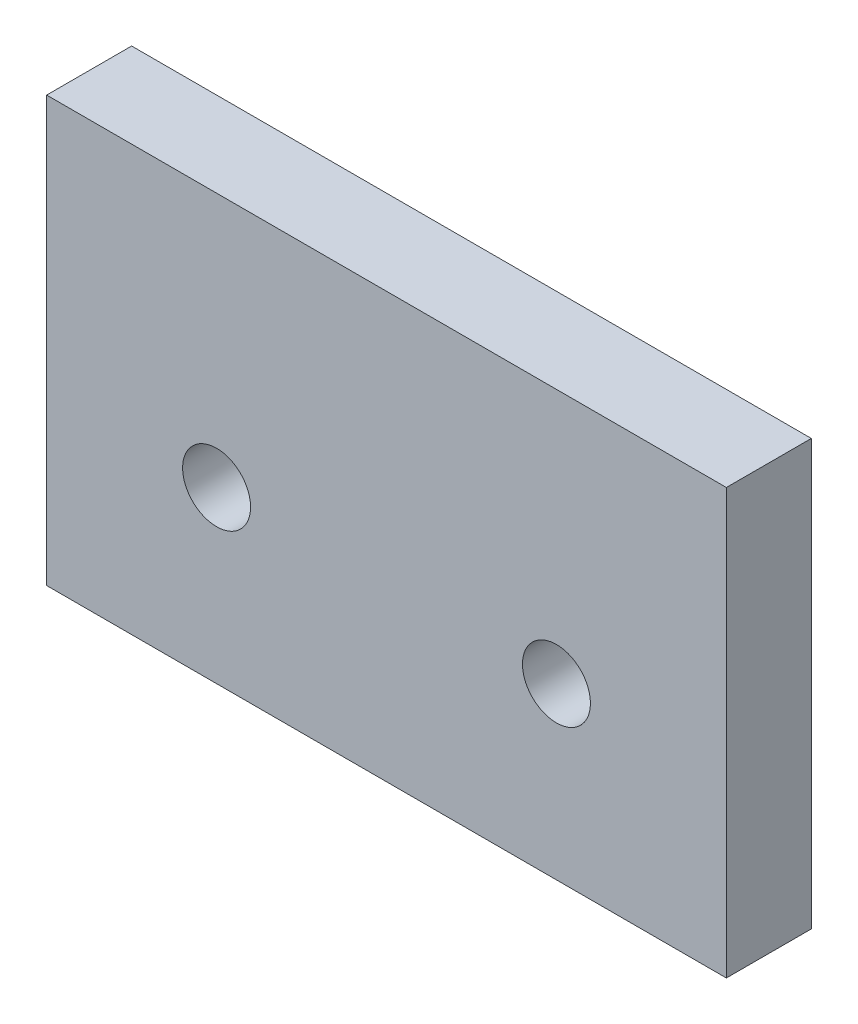
from build123d import *

# Parameters (mm, degrees)
BOSS_EXTRUDE1_DEPTH = 25.4
SKETCH2_R           = 1.27
CUT_EXTRUDE1_DEPTH  = 25.4
SKETCH3_W           = 25.4
SKETCH3_H           = 3.175
CUT_EXTRUDE2_DEPTH  = 10.668


with BuildPart() as part:
    # Sketch1 → Boss-Extrude1 (new body)
    with BuildSketch(Plane(origin=(0, 0, 0), x_dir=(0, 0, -1), z_dir=(1, 0, 0))):
        Polygon((0, 0), (0, 12.7), (-3.175, 12.7), (-3.175, -3.175), (10.668, -3.175), (10.668, 0), align=None)
    extrude(amount=BOSS_EXTRUDE1_DEPTH)

    # Sketch2 → Cut-Extrude1 (cut)
    with BuildSketch(Plane.XY.offset(3.175)):
        with Locations((6.35, 3.175)):
            Circle(SKETCH2_R)
        with Locations((19.05, 3.175)):
            Circle(SKETCH2_R)
    extrude(amount=-CUT_EXTRUDE1_DEPTH, mode=Mode.SUBTRACT)

    # Sketch3 → Cut-Extrude2 (cut)
    with BuildSketch(Plane(origin=(0, 0, -10.668), x_dir=(-1, 0, 0), z_dir=(0, 0, -1))):
        with Locations((-12.7, -1.5875)):
            Rectangle(SKETCH3_W, SKETCH3_H)
    extrude(amount=-CUT_EXTRUDE2_DEPTH, mode=Mode.SUBTRACT)


solid = part.part
